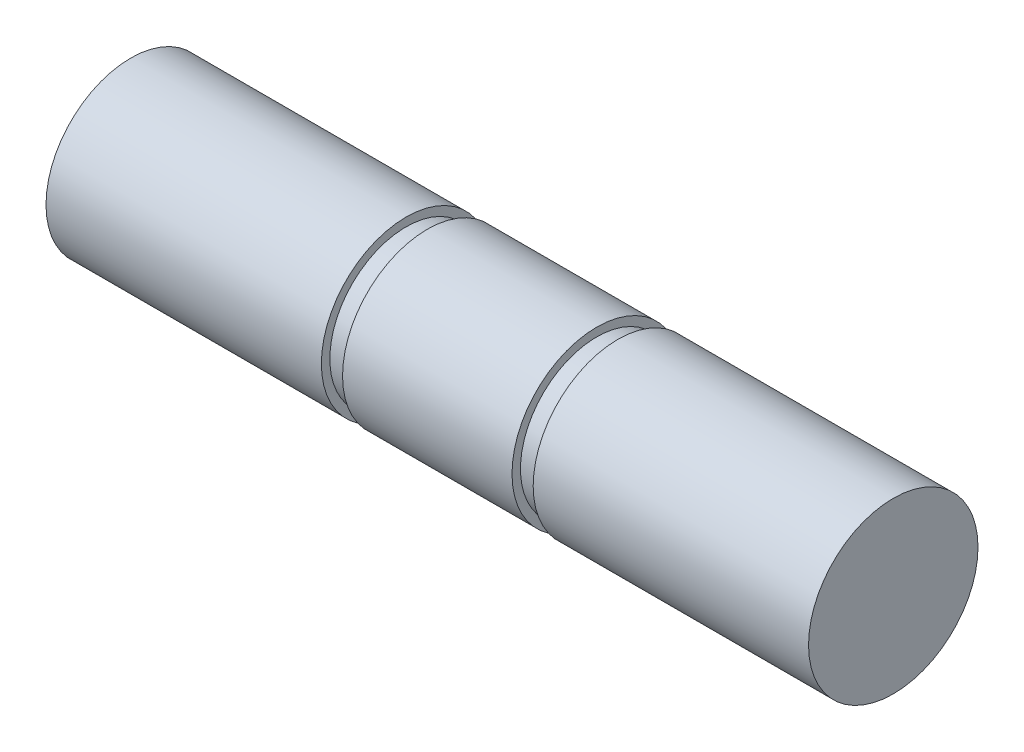
from build123d import *

# Parameters (mm, degrees)
SKETCH_1_R          = 2
EXTRUDE_1_DEPTH     = 18
CUT_EXTRUDE_START   = -7
SKETCH_2_R          = 2
SKETCH_2_R_2        = 1.8
CUT_EXTRUDE_1_DEPTH = 0.5


with BuildPart() as part:
    # 草图1 → 凸台-拉伸1 (new body)
    with BuildSketch(Plane(origin=(0, 0, 0), x_dir=(0, 0, -1), z_dir=(1, 0, 0))):
        Circle(SKETCH_1_R)
    extrude(amount=EXTRUDE_1_DEPTH)

    # 草图2 → 切除-拉伸1 (cut)
    with BuildSketch(Plane(origin=(18, 0, 0), x_dir=(0, 0, -1), z_dir=(1, 0, 0)).offset(CUT_EXTRUDE_START)):
        Circle(SKETCH_2_R)
        Circle(SKETCH_2_R_2, mode=Mode.SUBTRACT)
    cut_extrude_1 = extrude(amount=CUT_EXTRUDE_1_DEPTH, mode=Mode.SUBTRACT)

    # 镜向1: 切除-拉伸1 across plane
    add(cut_extrude_1.mirror(Plane(origin=(9, 0, 0), x_dir=(0, 0, 1), z_dir=(1, 0, 0))), mode=Mode.SUBTRACT)


solid = part.part
